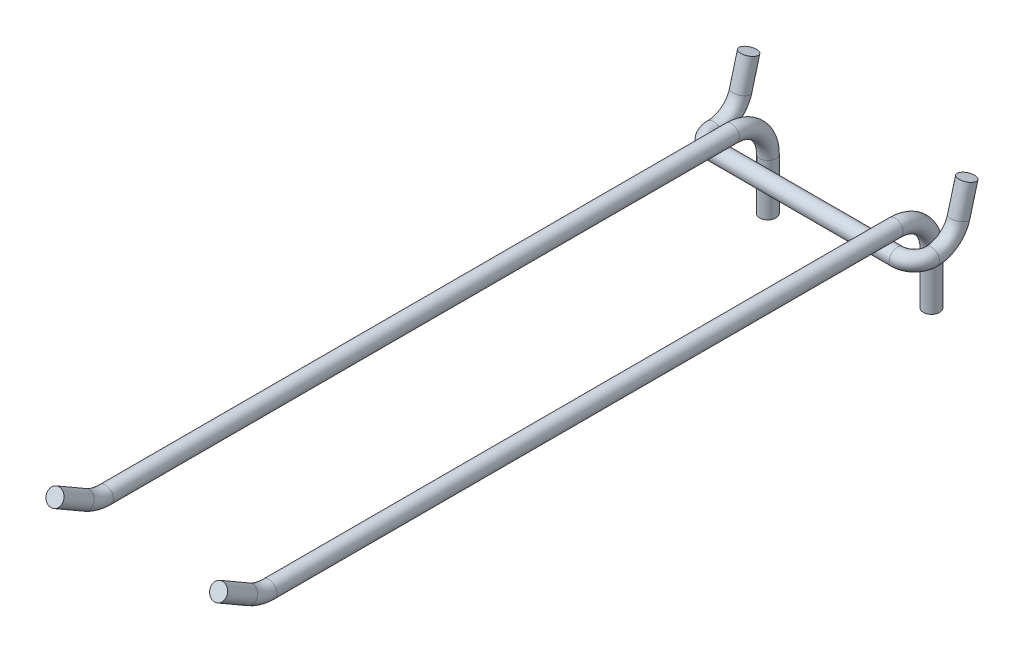
from build123d import *

# Parameters (mm, degrees)
SKETCH11_R       = 1.8796
SWEEP2_PROFILE_R = 1.8796
LPATTERN1_COUNT  = 2
LPATTERN1_PITCH  = 19.05


with BuildPart() as part:
    # Sweep1: sweep along a path in Sketch3
    with BuildLine(Plane(origin=(0, 0, 0), x_dir=(0, 0, -1), z_dir=(1, 0, 0))) as sweep1_path:
        Line((79.4893, -18.57375), (79.4893, -6.5786))
        ThreePointArc((79.4893, -6.5786), (77.562472671, -1.926827329), (72.9107, 0))
        Line((72.9107, 0), (-72.9107, 0))
        ThreePointArc((-72.9107, 0), (-75.855853678, 0.387736837), (-78.6003, 1.524523725))
        Line((-78.6003, 1.524523725), (-85.6107, 5.571980052))
    # Sketch11 → Sweep1 (sweep)
    with BuildSketch(Plane(origin=(0, -18.57375, 0), x_dir=(0, 0, -1), z_dir=(0, -1, 0))):
        with Locations((81.3689, 0)):
            Circle(SKETCH11_R)
    sweep(path=sweep1_path.line)


with BuildPart() as body_2:
    # Sweep2: sweep along a curve in space
    with BuildLine() as sweep2_path:
        Line((-25.4, 10.00125, -83.2485), (-25.4, 2.99633303, -81.371538155))
        ThreePointArc((-25.4, 2.99633303, -81.371538155), (-25.4, -0.520154284, -79.021896451), (-25.4, -1.8796, -75.017098514))
        ThreePointArc((-25.4, -1.8796, -75.017098514), (-24.232528065, -1.8796, -72.198571935), (-21.414001486, -1.8796, -71.0311))
        Line((-21.414001486, -1.8796, -71.0311), (21.414001486, -1.8796, -71.0311))
        ThreePointArc((21.414001486, -1.8796, -71.0311), (24.232528065, -1.8796, -72.198571935), (25.4, -1.8796, -75.017098514))
        ThreePointArc((25.4, -1.8796, -75.017098514), (25.4, -0.520154284, -79.021896451), (25.4, 2.99633303, -81.371538155))
        Line((25.4, 2.99633303, -81.371538155), (25.4, 10.00125, -83.2485))
    # Sweep2 profile (on start of the path) → Sweep2 (sweep)
    with BuildSketch(Plane(origin=(-25.4, 10.00125, -83.2485), x_dir=(0, -0.2588190451025188, -0.9659258262890689), z_dir=(0, -0.9659258262890689, 0.2588190451025188))):
        Circle(SWEEP2_PROFILE_R)
    sweep(path=sweep2_path.line)


with BuildPart() as lpattern1_1:
    # LPattern1: pattern copy
    add(part.part.moved(Location(Vector(-1, 0, 0) * (1 * LPATTERN1_PITCH))))


with BuildPart() as body_4:
    # Mirror1: mirrored copy
    add(lpattern1_1.part.mirror(Plane(origin=(0, 0, 0), x_dir=(0, 0, 1), z_dir=(1, 0, 0))))


solid = Compound([body_2.part, lpattern1_1.part, body_4.part])
